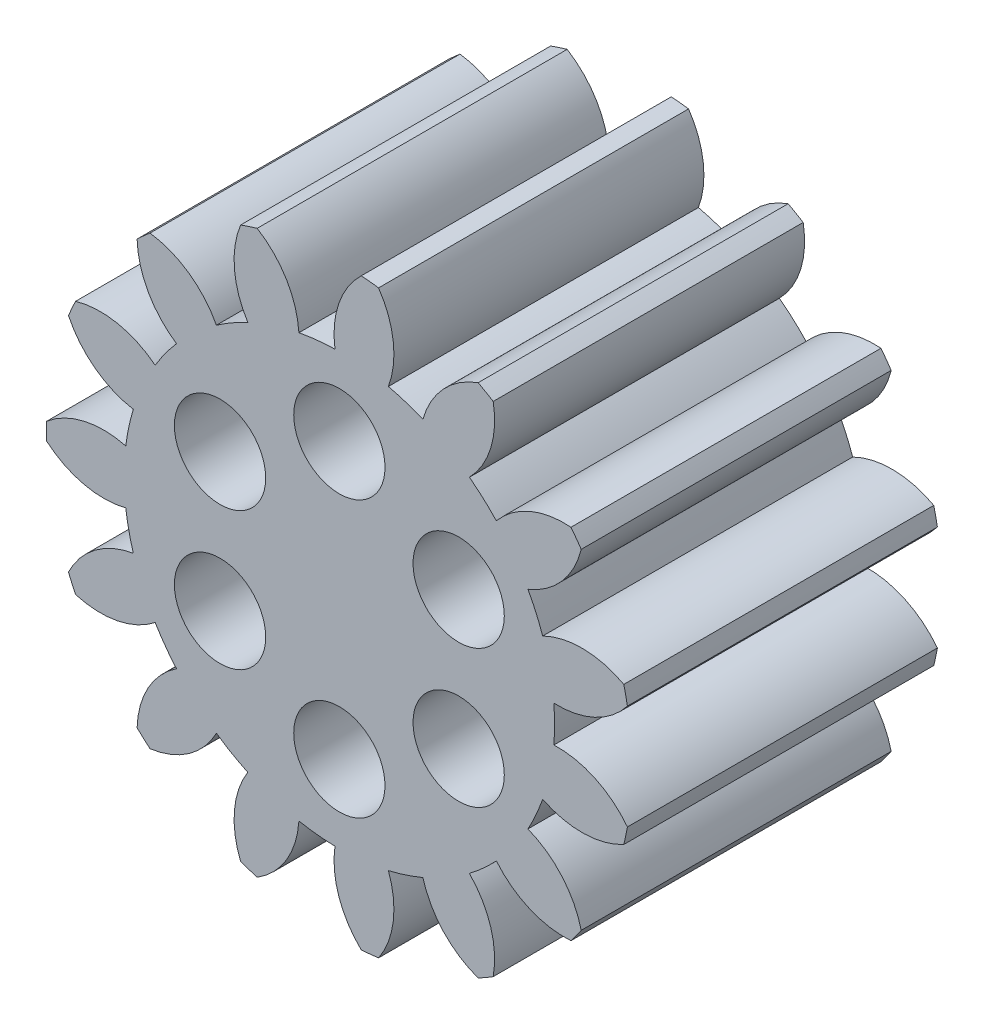
from build123d import *

# Parameters (mm, degrees)
SKETCH_1_R          = 12.5
EXTRUDE_2_DEPTH     = 5
EXTRUDE_START       = -5
EXTRUDE_4_DEPTH     = 5
SKETCH_5_R          = 2.65
CUT_EXTRUDE_1_DEPTH = 5
SKETCH_8_R          = 2.65
EXTRUDE_6_DEPTH     = 13


with BuildPart() as part:
    # 草图1 → 凸台-拉伸2 (new body)
    with BuildSketch(Plane.XY):
        Circle(SKETCH_1_R)
    extrude(amount=EXTRUDE_2_DEPTH)

    # 草图4 → 凸台-拉伸4 (add)
    with BuildSketch(Plane.XY.offset(5).offset(EXTRUDE_START)):
        with BuildLine():
            ThreePointArc((7.551754202, 9.960974273), (8.789798259, 12.044342407), (8.933409377, 14.463547176))
            ThreePointArc((8.933409377, 14.463547176), (8.5, 14.722431864), (8.059094594, 14.968333051))
            ThreePointArc((8.059094594, 14.968333051), (6.035807367, 13.63435979), (4.850579666, 11.520498119))
            ThreePointArc((4.850579666, 11.520498119), (6.25, 10.825317547), (7.551754202, 9.960974273))
        make_face()
        with BuildLine():
            ThreePointArc((10.950363986, 6.028227648), (12.928755671, 7.427921259), (14.043930183, 9.579562882))
            ThreePointArc((14.043930183, 9.579562882), (13.753288904, 9.992349289), (13.450518797, 10.396323586))
            ThreePointArc((13.450518797, 10.396323586), (11.059578134, 10.000623427), (9.117033752, 8.551590236))
            ThreePointArc((9.117033752, 8.551590236), (10.11271243, 7.347315654), (10.950363986, 6.028227648))
        make_face()
        with BuildLine():
            ThreePointArc((12.455556356, 1.053145697), (14.832213775, 1.527145045), (16.726127875, 3.039185139))
            ThreePointArc((16.726127875, 3.039185139), (16.628509212, 3.534498744), (16.516226105, 4.026695325))
            ThreePointArc((16.516226105, 4.026695325), (14.17104737, 4.637688421), (11.807069877, 4.104034712))
            ThreePointArc((11.807069877, 4.104034712), (12.226845009, 2.598896135), (12.455556356, 1.053145697))
        make_face()
        with BuildLine():
            ThreePointArc((16.516226105, -4.026695325), (16.628509212, -3.534498744), (16.726127875, -3.039185139))
            ThreePointArc((16.726127875, -3.039185139), (14.832213775, -1.527145045), (12.455556356, -1.053145697))
            ThreePointArc((12.455556356, -1.053145697), (12.226845009, -2.598896135), (11.807069877, -4.104034712))
            ThreePointArc((11.807069877, -4.104034712), (14.17104737, -4.637688421), (16.516226105, -4.026695325))
        make_face()
        with BuildLine():
            ThreePointArc((13.450518797, -10.396323586), (13.753288904, -9.992349289), (14.043930183, -9.579562882))
            ThreePointArc((14.043930183, -9.579562882), (12.928755671, -7.427921259), (10.950363986, -6.028227648))
            ThreePointArc((10.950363986, -6.028227648), (10.11271243, -7.347315654), (9.117033752, -8.551590236))
            ThreePointArc((9.117033752, -8.551590236), (11.059578134, -10.000623427), (13.450518797, -10.396323586))
        make_face()
        with BuildLine():
            ThreePointArc((8.059094594, -14.968333051), (8.5, -14.722431864), (8.933409377, -14.463547176))
            ThreePointArc((8.933409377, -14.463547176), (8.789798259, -12.044342407), (7.551754202, -9.960974273))
            ThreePointArc((7.551754202, -9.960974273), (6.25, -10.825317547), (4.850579666, -11.520498119))
            ThreePointArc((4.850579666, -11.520498119), (6.035807367, -13.63435979), (8.059094594, -14.968333051))
        make_face()
        with BuildLine():
            ThreePointArc((1.274179722, -16.952181749), (1.776983876, -16.906872221), (2.278220933, -16.846652765))
            ThreePointArc((2.278220933, -16.846652765), (3.131004874, -14.578187333), (2.847377511, -12.171377955))
            ThreePointArc((2.847377511, -12.171377955), (1.306605791, -12.431523692), (-0.25458371, -12.497407216))
            ThreePointArc((-0.25458371, -12.497407216), (-0.031609328, -14.91059148), (1.274179722, -16.952181749))
        make_face()
        with BuildLine():
            ThreePointArc((-5.7310524, -16.004844216), (-5.253288904, -16.167960777), (-4.770892608, -16.316819044))
            ThreePointArc((-4.770892608, -16.316819044), (-3.069167697, -14.591331231), (-2.34933662, -12.277239814))
            ThreePointArc((-2.34933662, -12.277239814), (-3.86271243, -11.888206454), (-5.315727251, -11.313401071))
            ThreePointArc((-5.315727251, -11.313401071), (-6.093560483, -13.608646446), (-5.7310524, -16.004844216))
        make_face()
        with BuildLine():
            ThreePointArc((-11.745333497, -12.290123719), (-11.375220308, -12.633462033), (-10.995075475, -12.965659077))
            ThreePointArc((-10.995075475, -12.965659077), (-8.738653291, -12.081501401), (-7.139829106, -10.260255374))
            ThreePointArc((-7.139829106, -10.260255374), (-8.364132579, -9.289310318), (-9.457733257, -8.173205102))
            ThreePointArc((-9.457733257, -8.173205102), (-11.101879672, -9.95364281), (-11.745333497, -12.290123719))
        make_face()
        with BuildLine():
            ThreePointArc((2.847377511, 12.171377955), (3.131004874, 14.578187333), (2.278220933, 16.846652765))
            ThreePointArc((2.278220933, 16.846652765), (1.776983876, 16.906872221), (1.274179722, 16.952181749))
            ThreePointArc((1.274179722, 16.952181749), (-0.031609328, 14.91059148), (-0.25458371, 12.497407216))
            ThreePointArc((-0.25458371, 12.497407216), (1.306605791, 12.431523692), (2.847377511, 12.171377955))
        make_face()
        with BuildLine():
            ThreePointArc((-2.34933662, 12.277239814), (-3.069167697, 14.591331231), (-4.770892608, 16.316819044))
            ThreePointArc((-4.770892608, 16.316819044), (-5.253288904, 16.167960777), (-5.7310524, 16.004844216))
            ThreePointArc((-5.7310524, 16.004844216), (-6.093560483, 13.608646446), (-5.315727251, 11.313401071))
            ThreePointArc((-5.315727251, 11.313401071), (-3.86271243, 11.888206454), (-2.34933662, 12.277239814))
        make_face()
        with BuildLine():
            ThreePointArc((-7.139829106, 10.260255374), (-8.738653291, 12.081501401), (-10.995075475, 12.965659077))
            ThreePointArc((-10.995075475, 12.965659077), (-11.375220308, 12.633462033), (-11.745333497, 12.290123719))
            ThreePointArc((-11.745333497, 12.290123719), (-11.101879672, 9.95364281), (-9.457733257, 8.173205102))
            ThreePointArc((-9.457733257, 8.173205102), (-8.364132579, 9.289310318), (-7.139829106, 10.260255374))
        make_face()
        with BuildLine():
            ThreePointArc((-10.695780276, 6.469179569), (-12.897146343, 7.482670221), (-15.318109905, 7.372618866))
            ThreePointArc((-15.318109905, 7.372618866), (-15.53027278, 6.914522932), (-15.72873973, 6.450329179))
            ThreePointArc((-15.72873973, 6.450329179), (-14.190583009, 4.577563906), (-11.964411263, 3.619787719))
            ThreePointArc((-11.964411263, 3.619787719), (-11.419318221, 5.084208038), (-10.695780276, 6.469179569))
        make_face()
        with BuildLine():
            ThreePointArc((-12.402333868, 1.559523845), (-14.825605626, 1.590017383), (-16.992503971, 0.504785875))
            ThreePointArc((-16.992503971, 0.504785875), (-17, 0), (-16.992503971, -0.504785875))
            ThreePointArc((-16.992503971, -0.504785875), (-14.825605626, -1.590017383), (-12.402333868, -1.559523845))
            ThreePointArc((-12.402333868, -1.559523845), (-12.5, 0), (-12.402333868, 1.559523845))
        make_face()
        with BuildLine():
            ThreePointArc((-15.72873973, -6.450329179), (-15.53027278, -6.914522932), (-15.318109905, -7.372618866))
            ThreePointArc((-15.318109905, -7.372618866), (-12.897146343, -7.482670221), (-10.695780276, -6.469179569))
            ThreePointArc((-10.695780276, -6.469179569), (-11.419318221, -5.084208038), (-11.964411263, -3.619787719))
            ThreePointArc((-11.964411263, -3.619787719), (-14.190583009, -4.577563906), (-15.72873973, -6.450329179))
        make_face()
    extrude(amount=EXTRUDE_4_DEPTH)

    # 草图5 → 切除-拉伸1 (cut)
    with BuildSketch(Plane(origin=(0, 0, 0), x_dir=(-1, 0, 0), z_dir=(0, 0, -1))):
        with Locations((0, 8)):
            Circle(SKETCH_5_R)
        with Locations((6.92820323, 4)):
            Circle(SKETCH_5_R)
        with Locations((6.92820323, -4)):
            Circle(SKETCH_5_R)
        with Locations((0, -8)):
            Circle(SKETCH_5_R)
        with Locations((-6.92820323, -4)):
            Circle(SKETCH_5_R)
        with Locations((-6.92820323, 4)):
            Circle(SKETCH_5_R)
    extrude(amount=-CUT_EXTRUDE_1_DEPTH, mode=Mode.SUBTRACT)

    # 草图8 → 凸台-拉伸6 (add)
    with BuildSketch(Plane.XY.offset(5)):
        with BuildLine():
            ThreePointArc((-0.25458371, 12.497407216), (-1.306605791, 12.431523692), (-2.34933662, 12.277239814))
            ThreePointArc((-2.34933662, 12.277239814), (-3.069167697, 14.591331231), (-4.770892608, 16.316819044))
            ThreePointArc((-4.770892608, 16.316819044), (-5.253288904, 16.167960777), (-5.7310524, 16.004844216))
            ThreePointArc((-5.7310524, 16.004844216), (-6.093560483, 13.608646446), (-5.315727251, 11.313401071))
            ThreePointArc((-5.315727251, 11.313401071), (-6.25, 10.825317547), (-7.139829106, 10.260255374))
            ThreePointArc((-7.139829106, 10.260255374), (-8.738653291, 12.081501401), (-10.995075475, 12.965659077))
            ThreePointArc((-10.995075475, 12.965659077), (-11.375220308, 12.633462033), (-11.745333497, 12.290123719))
            ThreePointArc((-11.745333497, 12.290123719), (-11.101879672, 9.95364281), (-9.457733257, 8.173205102))
            ThreePointArc((-9.457733257, 8.173205102), (-10.11271243, 7.347315654), (-10.695780276, 6.469179569))
            ThreePointArc((-10.695780276, 6.469179569), (-12.897146343, 7.482670221), (-15.318109905, 7.372618866))
            ThreePointArc((-15.318109905, 7.372618866), (-15.53027278, 6.914522932), (-15.72873973, 6.450329179))
            ThreePointArc((-15.72873973, 6.450329179), (-14.190583009, 4.577563906), (-11.964411263, 3.619787719))
            ThreePointArc((-11.964411263, 3.619787719), (-12.226845009, 2.598896135), (-12.402333868, 1.559523845))
            ThreePointArc((-12.402333868, 1.559523845), (-14.825605626, 1.590017383), (-16.992503971, 0.504785875))
            ThreePointArc((-16.992503971, 0.504785875), (-17, 0), (-16.992503971, -0.504785875))
            ThreePointArc((-16.992503971, -0.504785875), (-14.825605626, -1.590017383), (-12.402333868, -1.559523845))
            ThreePointArc((-12.402333868, -1.559523845), (-12.226845009, -2.598896135), (-11.964411263, -3.619787719))
            ThreePointArc((-11.964411263, -3.619787719), (-14.190583009, -4.577563906), (-15.72873973, -6.450329179))
            ThreePointArc((-15.72873973, -6.450329179), (-15.53027278, -6.914522932), (-15.318109905, -7.372618866))
            ThreePointArc((-15.318109905, -7.372618866), (-12.897146343, -7.482670221), (-10.695780276, -6.469179569))
            ThreePointArc((-10.695780276, -6.469179569), (-10.11271243, -7.347315654), (-9.457733257, -8.173205102))
            ThreePointArc((-9.457733257, -8.173205102), (-11.101879672, -9.95364281), (-11.745333497, -12.290123719))
            ThreePointArc((-11.745333497, -12.290123719), (-11.375220308, -12.633462033), (-10.995075475, -12.965659077))
            ThreePointArc((-10.995075475, -12.965659077), (-8.738653291, -12.081501401), (-7.139829106, -10.260255374))
            ThreePointArc((-7.139829106, -10.260255374), (-6.25, -10.825317547), (-5.315727251, -11.313401071))
            ThreePointArc((-5.315727251, -11.313401071), (-6.093560483, -13.608646446), (-5.7310524, -16.004844216))
            ThreePointArc((-5.7310524, -16.004844216), (-5.253288904, -16.167960777), (-4.770892608, -16.316819044))
            ThreePointArc((-4.770892608, -16.316819044), (-3.069167697, -14.591331231), (-2.34933662, -12.277239814))
            ThreePointArc((-2.34933662, -12.277239814), (-1.306605791, -12.431523692), (-0.25458371, -12.497407216))
            ThreePointArc((-0.25458371, -12.497407216), (-0.031609328, -14.91059148), (1.274179722, -16.952181749))
            ThreePointArc((1.274179722, -16.952181749), (1.776983876, -16.906872221), (2.278220933, -16.846652765))
            ThreePointArc((2.278220933, -16.846652765), (3.131004874, -14.578187333), (2.847377511, -12.171377955))
            ThreePointArc((2.847377511, -12.171377955), (3.86271243, -11.888206454), (4.850579666, -11.520498119))
            ThreePointArc((4.850579666, -11.520498119), (6.035807367, -13.63435979), (8.059094594, -14.968333051))
            ThreePointArc((8.059094594, -14.968333051), (8.5, -14.722431864), (8.933409377, -14.463547176))
            ThreePointArc((8.933409377, -14.463547176), (8.789798259, -12.044342407), (7.551754202, -9.960974273))
            ThreePointArc((7.551754202, -9.960974273), (8.364132579, -9.289310318), (9.117033752, -8.551590236))
            ThreePointArc((9.117033752, -8.551590236), (11.059578134, -10.000623427), (13.450518797, -10.396323586))
            ThreePointArc((13.450518797, -10.396323586), (13.753288904, -9.992349289), (14.043930183, -9.579562882))
            ThreePointArc((14.043930183, -9.579562882), (12.928755671, -7.427921259), (10.950363986, -6.028227648))
            ThreePointArc((10.950363986, -6.028227648), (11.419318221, -5.084208038), (11.807069877, -4.104034712))
            ThreePointArc((11.807069877, -4.104034712), (14.17104737, -4.637688421), (16.516226105, -4.026695325))
            ThreePointArc((16.516226105, -4.026695325), (16.628509212, -3.534498744), (16.726127875, -3.039185139))
            ThreePointArc((16.726127875, -3.039185139), (14.832213775, -1.527145045), (12.455556356, -1.053145697))
            ThreePointArc((12.455556356, -1.053145697), (12.5, 0), (12.455556356, 1.053145697))
            ThreePointArc((12.455556356, 1.053145697), (14.832213775, 1.527145045), (16.726127875, 3.039185139))
            ThreePointArc((16.726127875, 3.039185139), (16.628509212, 3.534498744), (16.516226105, 4.026695325))
            ThreePointArc((16.516226105, 4.026695325), (14.17104737, 4.637688421), (11.807069877, 4.104034712))
            ThreePointArc((11.807069877, 4.104034712), (11.419318221, 5.084208038), (10.950363986, 6.028227648))
            ThreePointArc((10.950363986, 6.028227648), (12.928755671, 7.427921259), (14.043930183, 9.579562882))
            ThreePointArc((14.043930183, 9.579562882), (13.753288904, 9.992349289), (13.450518797, 10.396323586))
            ThreePointArc((13.450518797, 10.396323586), (11.059578134, 10.000623427), (9.117033752, 8.551590236))
            ThreePointArc((9.117033752, 8.551590236), (8.364132579, 9.289310318), (7.551754202, 9.960974273))
            ThreePointArc((7.551754202, 9.960974273), (8.789798259, 12.044342407), (8.933409377, 14.463547176))
            ThreePointArc((8.933409377, 14.463547176), (8.5, 14.722431864), (8.059094594, 14.968333051))
            ThreePointArc((8.059094594, 14.968333051), (6.035807367, 13.63435979), (4.850579666, 11.520498119))
            ThreePointArc((4.850579666, 11.520498119), (3.86271243, 11.888206454), (2.847377511, 12.171377955))
            ThreePointArc((2.847377511, 12.171377955), (3.131004874, 14.578187333), (2.278220933, 16.846652765))
            ThreePointArc((2.278220933, 16.846652765), (1.776983876, 16.906872221), (1.274179722, 16.952181749))
            ThreePointArc((1.274179722, 16.952181749), (-0.031609328, 14.91059148), (-0.25458371, 12.497407216))
        make_face()
        with Locations(Location((6.92820323, 4, 0), (0, 0, 180))):
            Circle(SKETCH_8_R, mode=Mode.SUBTRACT)
        with Locations(Location((0, 8, 0), (0, 0, 180))):
            Circle(SKETCH_8_R, mode=Mode.SUBTRACT)
        with Locations(Location((6.92820323, -4, 0), (0, 0, 180))):
            Circle(SKETCH_8_R, mode=Mode.SUBTRACT)
        with Locations(Location((0, -8, 0), (0, 0, 180))):
            Circle(SKETCH_8_R, mode=Mode.SUBTRACT)
        with Locations(Location((-6.92820323, -4, 0), (0, 0, 180))):
            Circle(SKETCH_8_R, mode=Mode.SUBTRACT)
        with Locations(Location((-6.92820323, 4, 0), (0, 0, 180))):
            Circle(SKETCH_8_R, mode=Mode.SUBTRACT)
    extrude(amount=EXTRUDE_6_DEPTH)


solid = part.part
